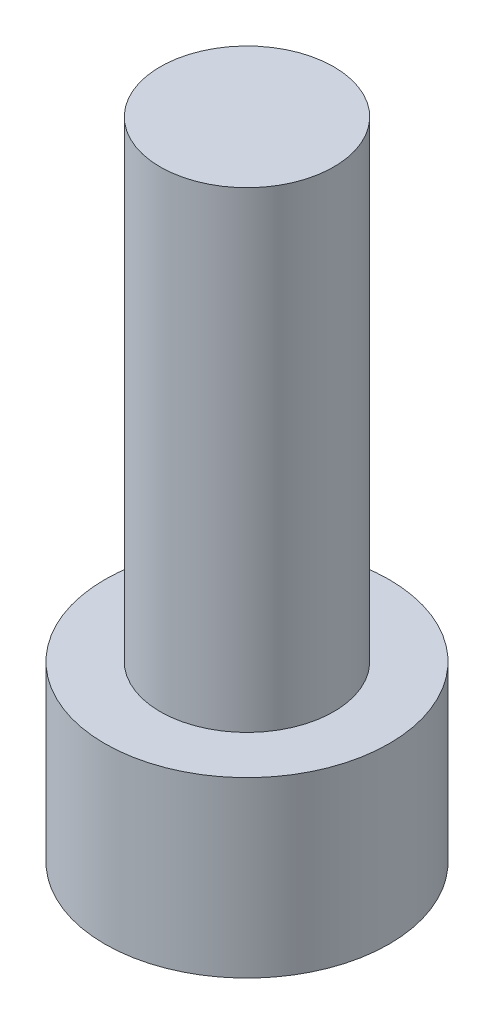
from build123d import *

# Parameters (mm, degrees)
SKETCH1_R           = 2.8702
BOSS_EXTRUDE1_DEPTH = 3.5052
SKETCH2_R           = 1.7526
BOSS_EXTRUDE2_DEPTH = 9.525


with BuildPart() as part:
    # Sketch1 → Boss-Extrude1 (new body)
    with BuildSketch(Plane(origin=(0, 0, 0), x_dir=(1, 0, 0), z_dir=(0, 1, 0))):
        with Locations(Location((0, 0, 0), (0, 0, 270))):
            Circle(SKETCH1_R)
    extrude(amount=BOSS_EXTRUDE1_DEPTH)

    # Sketch2 → Boss-Extrude2 (add)
    with BuildSketch(Plane(origin=(0, 3.5052, 0), x_dir=(1, 0, 0), z_dir=(0, 1, 0))):
        with Locations(Location((0, 0, 0), (0, 0, 90))):
            Circle(SKETCH2_R)
    extrude(amount=BOSS_EXTRUDE2_DEPTH)


solid = part.part
